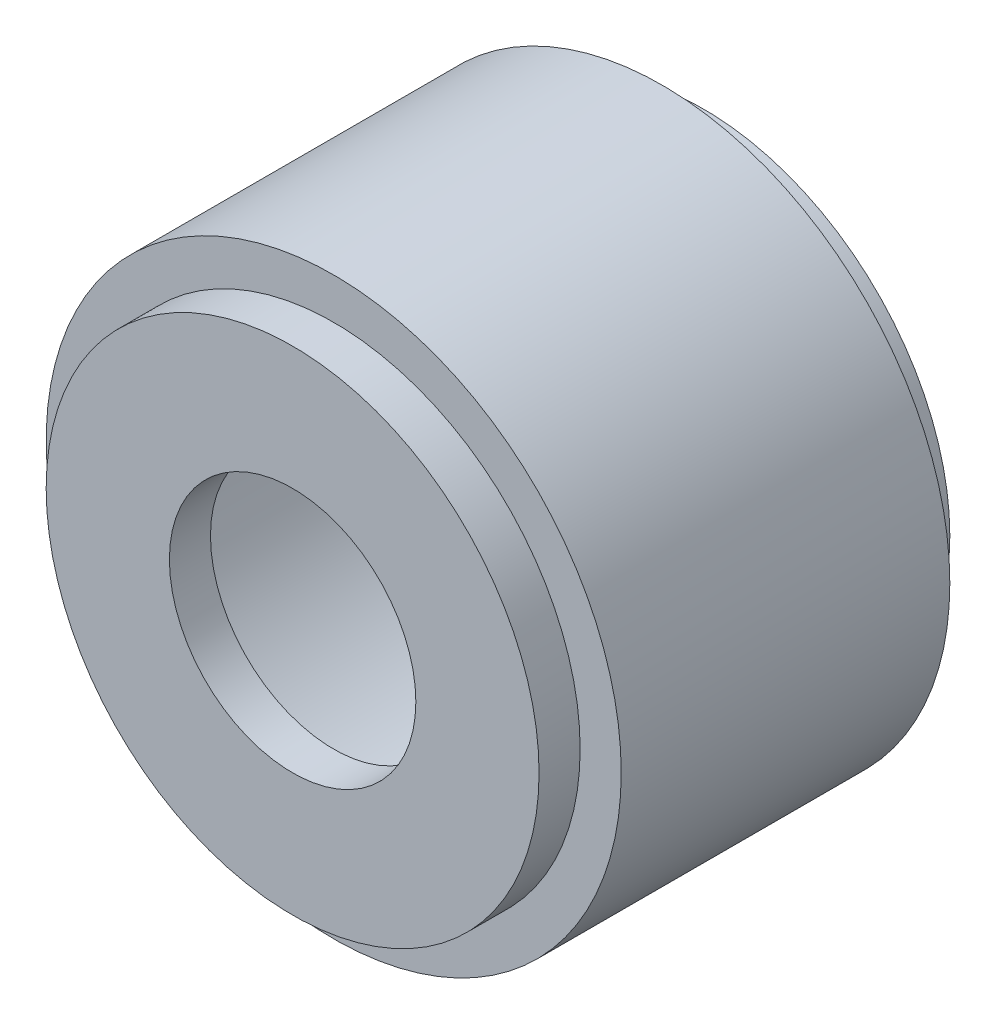
from build123d import *


with BuildPart() as part:
    # Croquis3 → Revolución1 (revolve)
    with BuildSketch(Plane(origin=(0, 0, 0), x_dir=(0, 0, -1), z_dir=(1, 0, 0)), mode=Mode.PRIVATE) as revoluci_n1_sk:
        Polygon((40, 0), (50, 0), (50, 60), (40, 60), (40, 70), (-40, 70), (-40, 60), (-50, 60), (-50, 30), (-40, 30), (-40, 50), (-30, 50), (-30, 60), (30, 60), (30, 50), (40, 50), align=None)
    revolve(revoluci_n1_sk.sketch.rotate(Axis((0, 0, 147.034921683), (0, 0, -1)), 90), axis=Axis((0, 0, 147.034921683), (0, 0, -1)))


solid = part.part
